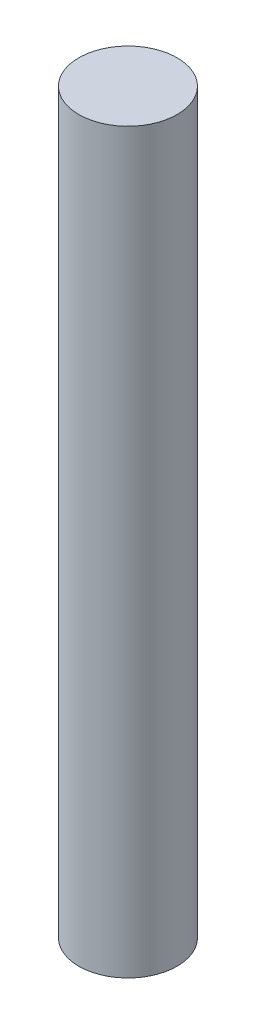
from build123d import *

# Parameters (mm, degrees)
SKETCH1_R           = 10
BOSS_EXTRUDE1_DEPTH = 150
SCALE1_SCALE        = 0.75


with BuildPart() as part:
    # Sketch1 → Boss-Extrude1 (new body)
    with BuildSketch(Plane(origin=(0, 0, 0), x_dir=(1, 0, 0), z_dir=(0, 1, 0))):
        with Locations(Location((0, 0, 0), (0, 0, 270))):
            Circle(SKETCH1_R)
    extrude(amount=BOSS_EXTRUDE1_DEPTH)


with BuildPart() as part_1:
    # Scale1: scaled about (0, 75, 0)
    add(part.part.scale(SCALE1_SCALE).moved(Location((0, 18.75, 0))))


solid = part_1.part
